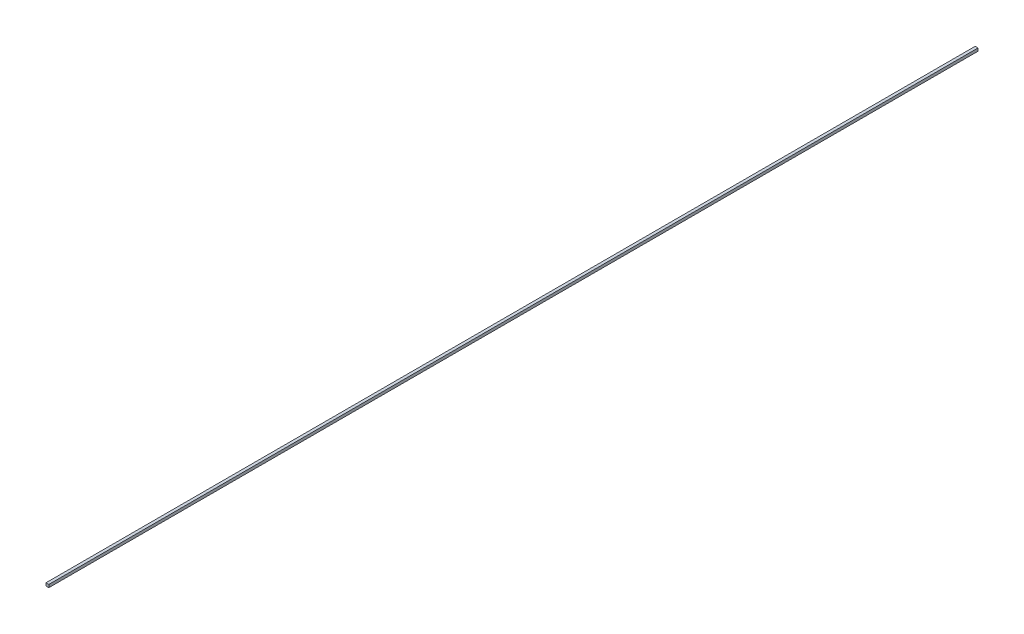
from build123d import *

# Parameters (mm, degrees)
SKETCH_1_W      = 2
SKETCH_1_H      = 2
EXTRUDE_1_DEPTH = 651.8


with BuildPart() as part:
    # 草图1 → 凸台-拉伸1 (new body)
    with BuildSketch(Plane.XY):
        with Locations((1, 1)):
            Rectangle(SKETCH_1_W, SKETCH_1_H)
    extrude(amount=EXTRUDE_1_DEPTH)


solid = part.part
